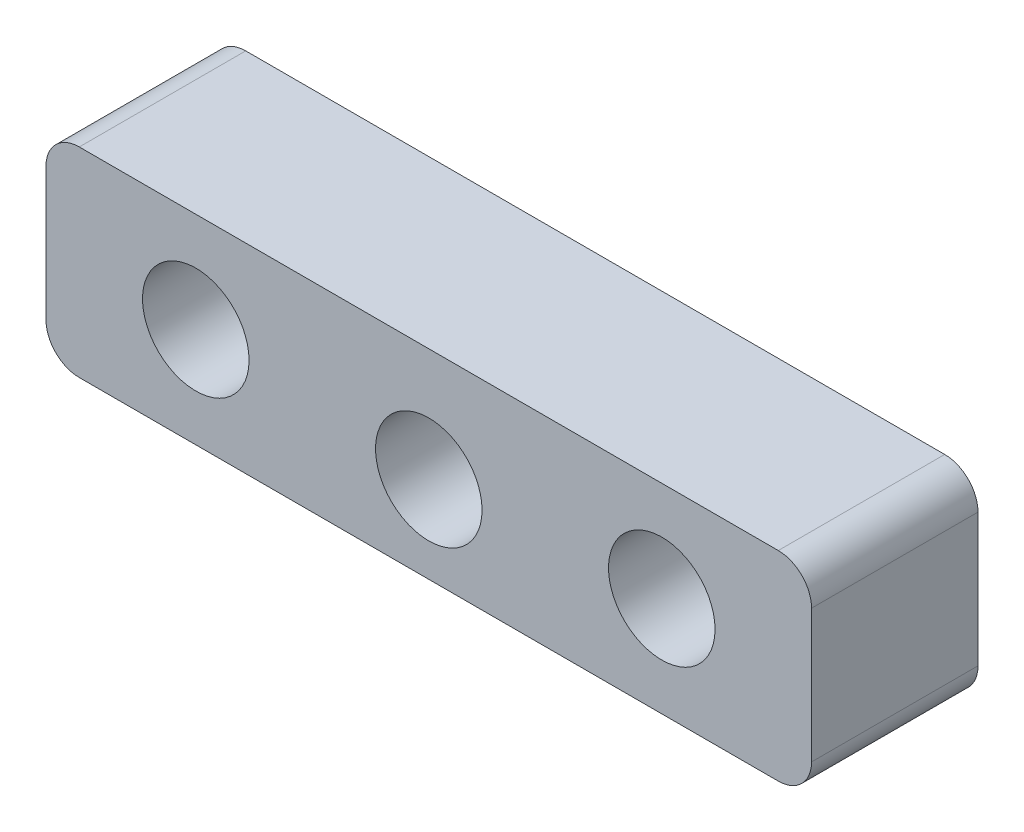
from build123d import *

# Parameters (mm, degrees)
SKETCH_1_W          = 23
SKETCH_1_H          = 6
EXTRUDE_1_DEPTH     = 5
SKETCH_2_R          = 1.6
CUT_EXTRUDE_1_DEPTH = 5
FILLET_1_R          = 1


with BuildPart() as part:
    # 草图1 → 凸台-拉伸1 (new body)
    with BuildSketch(Plane.XY):
        Rectangle(SKETCH_1_W, SKETCH_1_H)
    extrude(amount=EXTRUDE_1_DEPTH)

    # 草图2 → 切除-拉伸1 (cut)
    with BuildSketch(Plane.XY.offset(5)):
        with Locations((-7, 0)):
            Circle(SKETCH_2_R)
        with Locations((7, 0)):
            Circle(SKETCH_2_R)
        with Locations((0, -0.4)):
            Circle(SKETCH_2_R)
    extrude(amount=-CUT_EXTRUDE_1_DEPTH, mode=Mode.SUBTRACT)

    # 圆角1
    fillet_1_edges = [part.edges().sort_by_distance(p)[0] for p in [
        (11.5, -3, 2.5),
        (-11.5, -3, 2.5),
        (-11.5, 3, 2.5),
        (11.5, 3, 2.5),
    ]]
    fillet(fillet_1_edges, radius=FILLET_1_R)


solid = part.part
